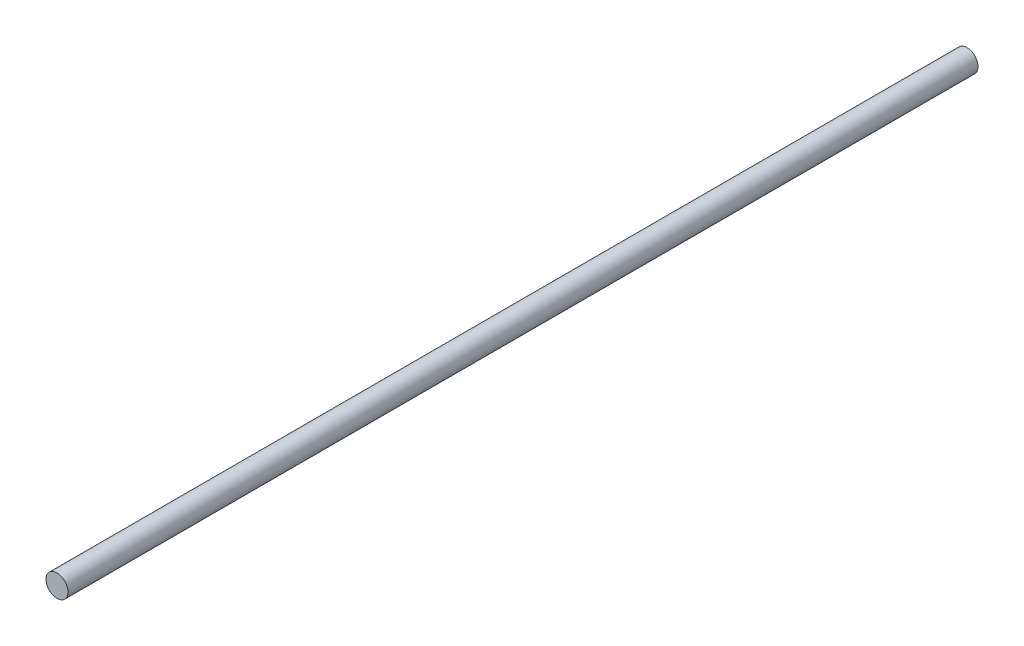
from build123d import *

# Parameters (mm, degrees)
SKETCH1_R           = 4
BOSS_EXTRUDE1_DEPTH = 165


with BuildPart() as part:
    # Sketch1 → Boss-Extrude1 (new, symmetric)
    with BuildSketch(Plane.XY):
        Circle(SKETCH1_R)
    extrude(amount=BOSS_EXTRUDE1_DEPTH, both=True)


solid = part.part
